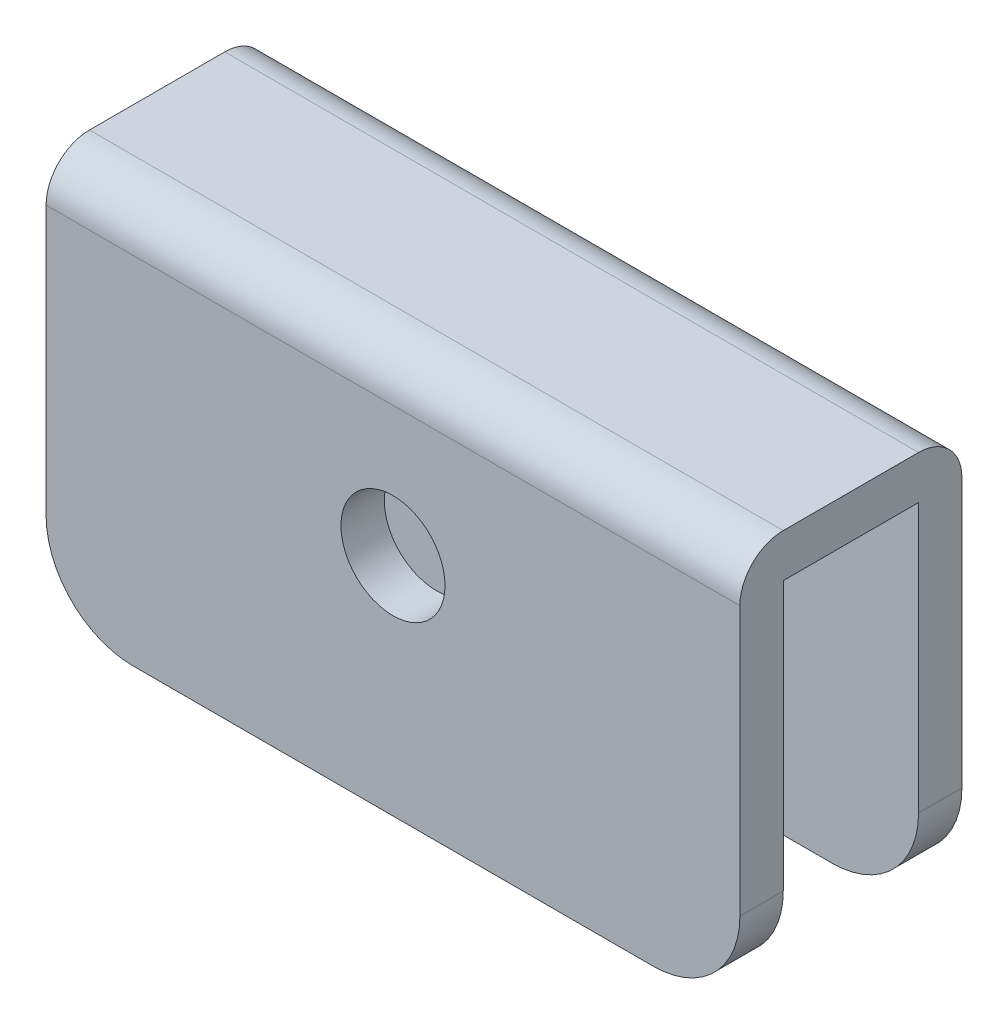
from build123d import *

# Parameters (mm, degrees)
BOSS_EXTRUDE1_DEPTH            = 6.4
BOSS_EXTRUDE1_DEPTH_BACK       = 6.4
SKETCH1_W                      = 40
SKETCH1_H                      = 23
CUT_EXTRUDE1_REACH             = 25.942
SKETCH2_W                      = 7.8
SKETCH2_H                      = 20.5
CUT_EXTRUDE1_DIRECTION_2_REACH = 25.942
FILLET1_R                      = 5
FILLET2_R                      = 2.5
CUT_EXTRUDE2_REACH             = 25.942
SKETCH3_R                      = 3
CUT_EXTRUDE2_DIRECTION_2_REACH = 25.942


with BuildPart() as part:
    # Sketch1 → Boss-Extrude1 (new, two sides: drawn at the far end of the back side and taken through both)
    with BuildSketch(Plane.XY.offset(-BOSS_EXTRUDE1_DEPTH_BACK)):
        Rectangle(SKETCH1_W, SKETCH1_H)
    extrude(amount=BOSS_EXTRUDE1_DEPTH + BOSS_EXTRUDE1_DEPTH_BACK)

    # Cut-Extrude1: up to this face of the body (flat: up to its plane)
    cut_extrude1_end = Plane(part.part.faces().sort_by_distance((-20, 0, 0))[0])
    # Sketch2 → Cut-Extrude1 (cut, up to the picked face)
    with BuildSketch(Plane(origin=(0, 0, 0), x_dir=(0, 0, -1), z_dir=(1, 0, 0)), mode=Mode.PRIVATE) as cut_extrude1_sk1:
        with Locations((0, -1.25)):
            Rectangle(SKETCH2_W, SKETCH2_H)
    cut_extrude1_tool1 = split(extrude(cut_extrude1_sk1.sketch, amount=-CUT_EXTRUDE1_REACH, mode=Mode.PRIVATE), bisect_by=cut_extrude1_end, keep=Keep.BOTH, mode=Mode.PRIVATE)
    add(cut_extrude1_tool1.solids().sort_by(Axis((0, -1.25, 0), (-1, 0, 0)))[0], mode=Mode.SUBTRACT)

    # Cut-Extrude1 direction 2: up to this face of the body (flat: up to its plane)
    cut_extrude1_direction_2_end = Plane(part.part.faces().sort_by_distance((20, 0, 0))[0])
    # Sketch2 → Cut-Extrude1 direction 2 (cut, up to the picked face)
    with BuildSketch(Plane(origin=(0, 0, 0), x_dir=(0, 0, -1), z_dir=(1, 0, 0)), mode=Mode.PRIVATE) as cut_extrude1_direction_2_sk1:
        with Locations((0, -1.25)):
            Rectangle(SKETCH2_W, SKETCH2_H)
    cut_extrude1_direction_2_tool1 = split(extrude(cut_extrude1_direction_2_sk1.sketch, amount=CUT_EXTRUDE1_DIRECTION_2_REACH, mode=Mode.PRIVATE), bisect_by=cut_extrude1_direction_2_end, keep=Keep.BOTH, mode=Mode.PRIVATE)
    add(cut_extrude1_direction_2_tool1.solids().sort_by(Axis((0, -1.25, 0), (1, 0, 0)))[0], mode=Mode.SUBTRACT)

    # Fillet1
    fillet1_edges = [part.edges().sort_by_distance(p)[0] for p in [
        (-20, -11.5, -5.15),
        (-20, -11.5, 5.15),
        (20, -11.5, -5.15),
        (20, -11.5, 5.15),
    ]]
    fillet(fillet1_edges, radius=FILLET1_R)

    # Fillet2
    fillet2_edges = [part.edges().sort_by_distance(p)[0] for p in [
        (0, 11.5, -6.4),
        (0, 11.5, 6.4),
    ]]
    fillet(fillet2_edges, radius=FILLET2_R)

    # Cut-Extrude2: up to this face of the body (flat: up to its plane)
    cut_extrude2_end = Plane(part.part.faces().sort_by_distance((0, -1.128903629, -6.4))[0])
    # Sketch3 → Cut-Extrude2 (cut, up to the picked face)
    with BuildSketch(Plane.XY, mode=Mode.PRIVATE) as cut_extrude2_sk1:
        with Locations((0, 1.5)):
            Circle(SKETCH3_R)
    cut_extrude2_tool1 = split(extrude(cut_extrude2_sk1.sketch, amount=-CUT_EXTRUDE2_REACH, mode=Mode.PRIVATE), bisect_by=cut_extrude2_end, keep=Keep.BOTH, mode=Mode.PRIVATE)
    add(cut_extrude2_tool1.solids().sort_by(Axis((0, 1.5, 0), (0, 0, -1)))[0], mode=Mode.SUBTRACT)

    # Cut-Extrude2 direction 2: up to this face of the body (flat: up to its plane)
    cut_extrude2_direction_2_end = Plane(part.part.faces().sort_by_distance((0, -1.128903629, 6.4))[0])
    # Sketch3 → Cut-Extrude2 direction 2 (cut, up to the picked face)
    with BuildSketch(Plane.XY, mode=Mode.PRIVATE) as cut_extrude2_direction_2_sk1:
        with Locations((0, 1.5)):
            Circle(SKETCH3_R)
    cut_extrude2_direction_2_tool1 = split(extrude(cut_extrude2_direction_2_sk1.sketch, amount=CUT_EXTRUDE2_DIRECTION_2_REACH, mode=Mode.PRIVATE), bisect_by=cut_extrude2_direction_2_end, keep=Keep.BOTH, mode=Mode.PRIVATE)
    add(cut_extrude2_direction_2_tool1.solids().sort_by(Axis((0, 1.5, 0), (0, 0, 1)))[0], mode=Mode.SUBTRACT)


solid = part.part
